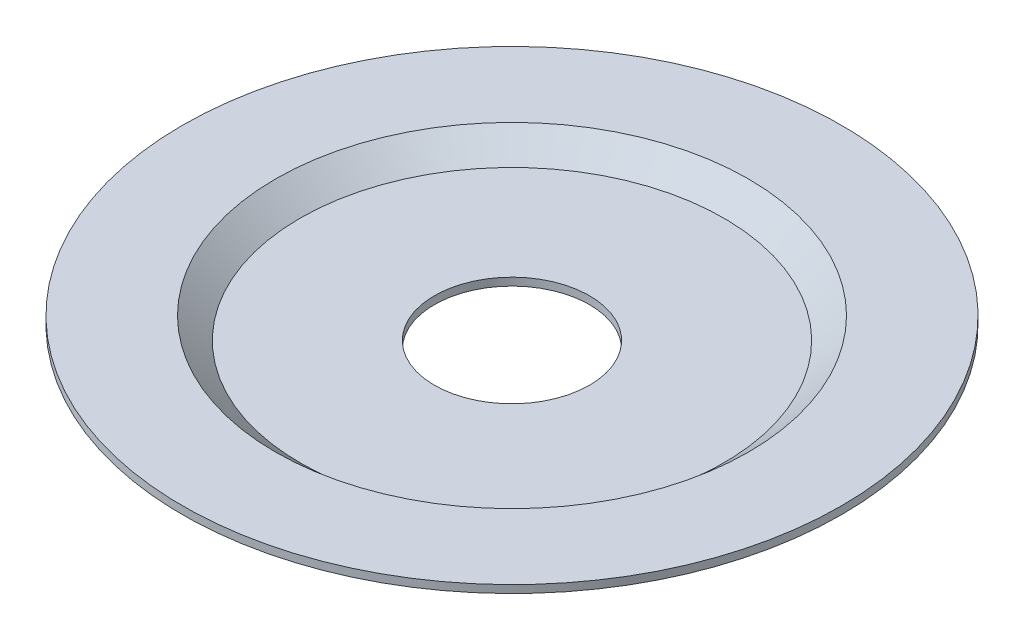
from build123d import *

# Parameters (mm, degrees)
SKETCH7_R          = 20
CUT_EXTRUDE1_DEPTH = 121.438221623


with BuildPart() as part:
    # Sketch6 → Revolve2 (revolve)
    with BuildSketch(Plane.XY, mode=Mode.PRIVATE) as revolve2_sk:
        Polygon((85, 0), (61.011931512, 0), (54.658752463, -5.575845989), (0.011931512, -5.575845989), (0.011931512, -7.575845989), (55.411931512, -7.575845989), (61.76511056, -2), (85, -2), align=None)
    revolve(revolve2_sk.sketch.rotate(Axis((0.011931512, 83.769679303, 0), (0, -1, 0)), 180), axis=Axis((0.011931512, 83.769679303, 0), (0, -1, 0)))

    # Sketch7 → Cut-Extrude1 (cut, through all)
    with BuildSketch(Plane.XZ.offset(7.575845989)):
        Circle(SKETCH7_R)
    extrude(amount=-CUT_EXTRUDE1_DEPTH, mode=Mode.SUBTRACT)


solid = part.part
